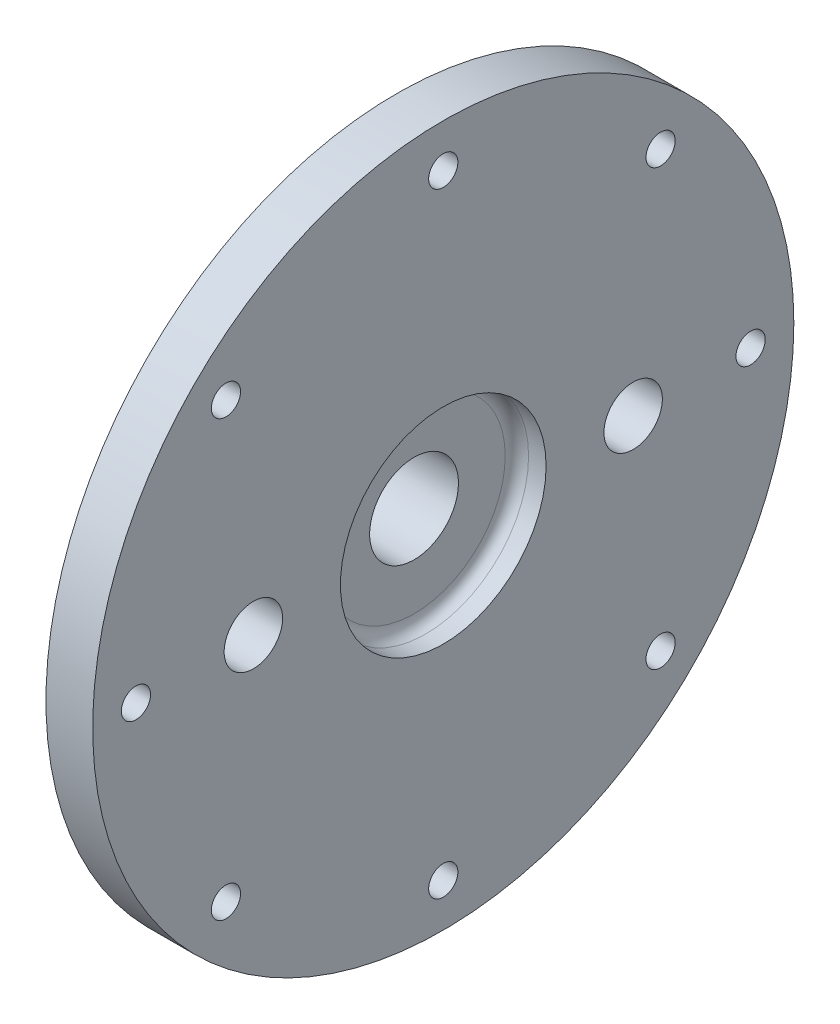
from build123d import *

# Parameters (mm, degrees)
CUT_EXTRUDE1_DEPTH      = 113.342968182
CUT_EXTRUDE1_DEPTH_BACK = 113.342968182
SKETCH2_R               = 6.35
SKETCH3_R               = 3.175
CUT_EXTRUDE2_DEPTH      = 113.342968182
CIRPATTERN1_COUNT       = 8


with BuildPart() as part:
    # Sketch1 → Revolve1 (revolve)
    with BuildSketch(Plane.XY, mode=Mode.PRIVATE) as revolve1_sk:
        with BuildLine():
            Line((0, 76.2), (-10.16, 76.2))
            Line((-10.16, 76.2), (-10.16, 21.082))
            ThreePointArc((-10.16, 21.082), (-11.647897552, 17.489897552), (-15.24, 16.002))
            Line((-15.24, 16.002), (-31.75, 16.002))
            Line((-31.75, 16.002), (-31.75, 9.652))
            Line((-31.75, 9.652), (-6.35, 9.652))
            Line((-6.35, 9.652), (-6.35, 19.812))
            ThreePointArc((-6.35, 19.812), (-5.606051224, 21.608051224), (-3.81, 22.352))
            Line((-3.81, 22.352), (0, 22.352))
            Line((0, 22.352), (0, 76.2))
        make_face()
    revolve(revolve1_sk.sketch.rotate(Axis((0, 0, 0), (-1, 0, 0)), 90), axis=Axis((0, 0, 0), (-1, 0, 0)))

    # Sketch2 → Cut-Extrude1 (cut, two sides: drawn at the far end of the back side and taken through both)
    with BuildSketch(Plane(origin=(0, 0, 0), x_dir=(0, 0, -1), z_dir=(1, 0, 0)).offset(-CUT_EXTRUDE1_DEPTH_BACK)):
        with Locations((41.275, 0)):
            Circle(SKETCH2_R)
        with Locations((-41.275, 0)):
            Circle(SKETCH2_R)
    extrude(amount=CUT_EXTRUDE1_DEPTH + CUT_EXTRUDE1_DEPTH_BACK, mode=Mode.SUBTRACT)

    # Sketch3 → Cut-Extrude2 (cut, through all)
    with BuildSketch(Plane(origin=(0, 0, 0), x_dir=(0, 0, -1), z_dir=(1, 0, 0))):
        with Locations((66.802, 0)):
            Circle(SKETCH3_R)
    cut_extrude2 = extrude(amount=-CUT_EXTRUDE2_DEPTH, mode=Mode.SUBTRACT)

    # CirPattern1: Cut-Extrude2 ×8 about axis
    cirpattern1_axis = Axis((0, 0, 0), (1, 0, 0))
    for i in range(1, CIRPATTERN1_COUNT):
        add(cut_extrude2.rotate(cirpattern1_axis, i * 360 / CIRPATTERN1_COUNT), mode=Mode.SUBTRACT)


solid = part.part
